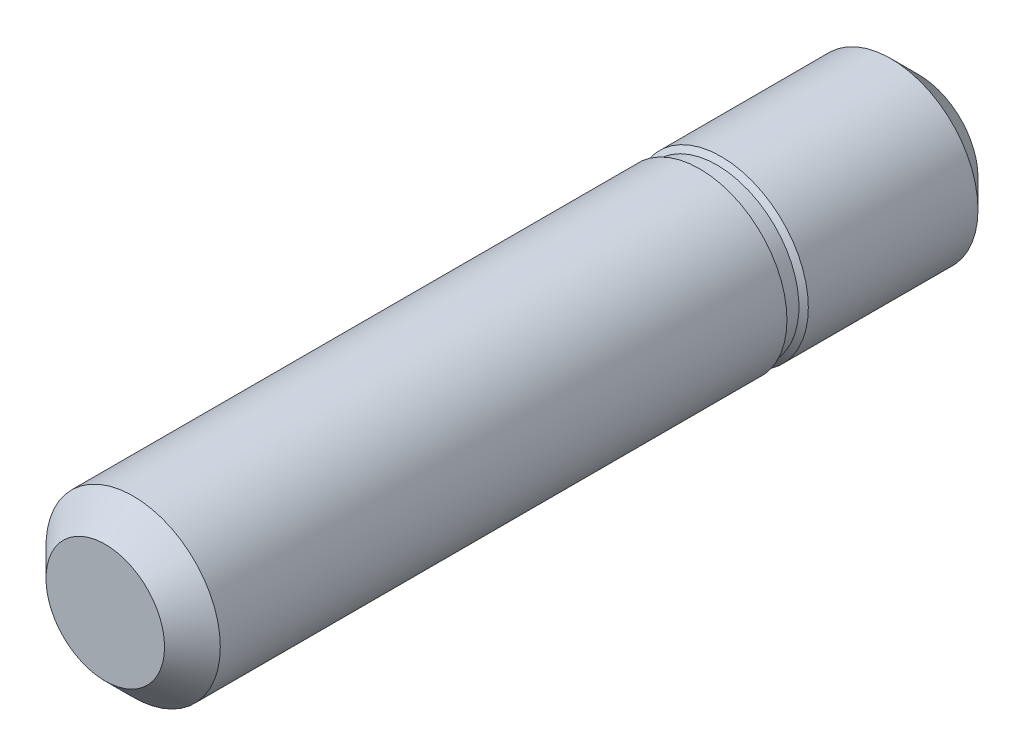
from build123d import *

# Parameters (mm, degrees)
SKETCH1_R           = 4.7625
BOSS_EXTRUDE1_DEPTH = 44.45
CHAMFER1_SIZE       = 1.524


with BuildPart() as part:
    # Sketch1 → Boss-Extrude1 (new body)
    with BuildSketch(Plane.XY):
        Circle(SKETCH1_R)
    extrude(amount=-BOSS_EXTRUDE1_DEPTH)

    # Sketch2 → Cut-Revolve1 (revolve, cut)
    with BuildSketch(Plane(origin=(0, 0, 0), x_dir=(1, 0, 0), z_dir=(0, 1, 0)), mode=Mode.PRIVATE) as cut_revolve1_sk:
        Polygon((-4.7625, 33.655), (-4.7625, 32.4866), (-4.4831, 32.4866), (-4.4831, 33.420555563), align=None)
    revolve(cut_revolve1_sk.sketch.rotate(Axis((0, 0, -44.45), (0, 0, 1)), 180), axis=Axis((0, 0, -44.45), (0, 0, 1)), mode=Mode.SUBTRACT)

    # Chamfer1
    chamfer1_edges = [part.edges().sort_by_distance(p)[0] for p in [
        (-4.7625, 0, 0),
        (-4.7625, 0, -44.45),
    ]]
    chamfer(chamfer1_edges, length=CHAMFER1_SIZE)


solid = part.part
